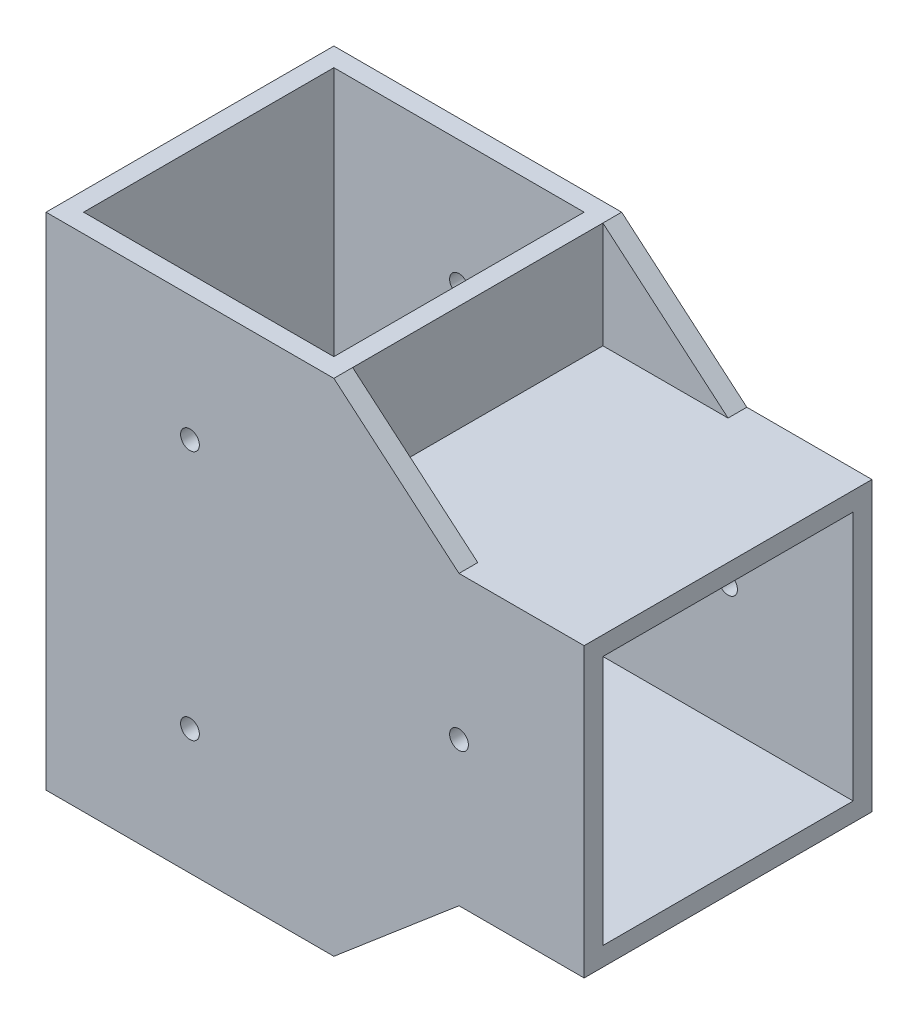
from build123d import *

# Parameters (mm, degrees)
BOSS_EXTRU_1_DEPTH           = 3
ESQUISSE2_W                  = 3
ESQUISSE2_H                  = 40
BOSS_EXTRU_2_DEPTH           = 20
ENL_V_MAT_EXTRU_1_DEPTH      = 90.844309781
ENL_V_MAT_EXTRU_1_DEPTH_BACK = 90.844309781
ESQUISSE3_R                  = 1.5


with BuildPart() as part:
    # Esquisse1 → Boss.-Extru.1 (new body)
    with BuildSketch(Plane.XY):
        Polygon((-66, 40), (-20, 40), (0, 23), (20, 23), (20, 0), (0, 0), (-66, 0), align=None)
    extrude(amount=BOSS_EXTRU_1_DEPTH)

    # Esquisse2 → Boss.-Extru.2 (add)
    with BuildSketch(Plane.XY.offset(3)):
        Polygon((20, 23), (-20, 23), (-20, 40), (-23, 40), (-23, 0), (-20, 0), (-20, 20), (20, 20), align=None)
        with Locations((-64.5, 20)):
            Rectangle(ESQUISSE2_W, ESQUISSE2_H)
    extrude(amount=BOSS_EXTRU_2_DEPTH)

    # Symétrie1: part across plane


with BuildPart() as part_1:
    add(part.part)
    add(part.part.mirror(Plane(origin=(20, 0, 3), x_dir=(0, 0, 1), z_dir=(0, 1, 0))))

    # Symétrie2: part across plane


with BuildPart() as part_2:
    add(part_1.part)
    add(part_1.part.mirror(Plane.XY.offset(23)))

    # Esquisse3 → Enlèv. mat.-Extru.1 (cut, two sides: drawn at the far end of the back side and taken through both)
    with BuildSketch(Plane.XY.offset(46).offset(-ENL_V_MAT_EXTRU_1_DEPTH_BACK)):
        with Locations((-43, 20)):
            Circle(ESQUISSE3_R)
        with Locations((-43, -20)):
            Circle(ESQUISSE3_R)
        Circle(ESQUISSE3_R)
    extrude(amount=ENL_V_MAT_EXTRU_1_DEPTH + ENL_V_MAT_EXTRU_1_DEPTH_BACK, mode=Mode.SUBTRACT)


solid = part_2.part
